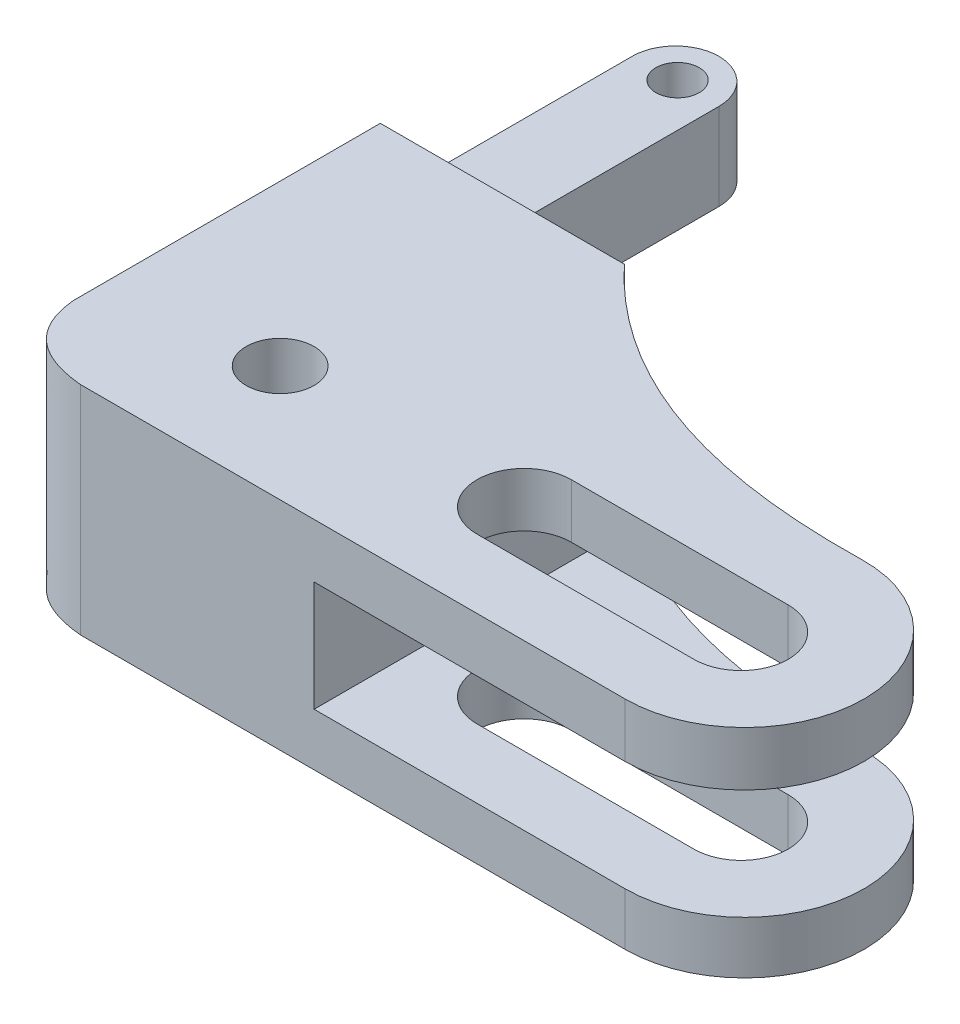
from build123d import *

# Parameters (mm, degrees)
SKETCH1_R           = 6.25
BOSS_EXTRUDE1_DEPTH = 40
SKETCH3_W           = 16
SKETCH3_H           = 16
BOSS_EXTRUDE2_DEPTH = 55
SKETCH4_W           = 79.487617275
SKETCH4_H           = 20.321855451
CUT_EXTRUDE1_DEPTH  = 60.08
CUT_EXTRUDE2_DEPTH  = 60.08
SKETCH8_R           = 4
CUT_EXTRUDE3_DEPTH  = 60.08


with BuildPart() as part:
    # Sketch1 → Boss-Extrude1 (new body)
    with BuildSketch(Plane(origin=(0, 0, 0), x_dir=(1, 0, 0), z_dir=(0, 1, 0))):
        with BuildLine():
            Line((-45, 0), (0, 0))
            add(Edge.make_bspline(
                [(0, 0), (17.365983088, -18.556062235), (40.507326339, -25.876534392), (69.05598636, -25.291140997)],
                knots=[0, 0, 0, 0, 1, 1, 1, 1], degree=3))
            ThreePointArc((69.05598636, -25.291140997), (91.549113489, -47.102951703), (69.507873161, -69.371305461))
            Line((69.507873161, -69.371305461), (-19.337413001, -69.371305461))
            Line((-19.337413001, -69.371305461), (-30.918760516, -69.371305461))
            add(Edge.make_bspline(
                [(-45, -56.695680455), (-43.898759302, -68.233062502), (-30.918760516, -69.371305461)],
                knots=[0, 0, 0, 1, 1, 1], degree=2))
            Line((-45, -56.695680455), (-45, -50.496042729))
            Line((-45, -50.496042729), (-45, 0))
        make_face()
        with Locations(Location((-15.478366003, -48, 0), (0, 0, 270))):
            Circle(SKETCH1_R, mode=Mode.SUBTRACT)
        with BuildLine():
            Line((29.521633997, -39.304319545), (69.521633997, -39.304319545))
            ThreePointArc((69.521633997, -39.304319545), (78.217314452, -48), (69.521633997, -56.695680455))
            Line((69.521633997, -56.695680455), (29.521633997, -56.695680455))
            ThreePointArc((29.521633997, -56.695680455), (20.825953542, -48), (29.521633997, -39.304319545))
        make_face(mode=Mode.SUBTRACT)
    extrude(amount=BOSS_EXTRUDE1_DEPTH)

    # Sketch3 → Boss-Extrude2 (add)
    with BuildSketch(Plane(origin=(0, 0, 0), x_dir=(-1, 0, 0), z_dir=(0, 0, -1))):
        with Locations((37, 19.479254529)):
            Rectangle(SKETCH3_W, SKETCH3_H)
    extrude(amount=BOSS_EXTRUDE2_DEPTH)

    # Sketch4 → Cut-Extrude1 (cut)
    with BuildSketch(Plane.XY.offset(69.371305461)):
        with Locations((51.911602749, 19.849304399)):
            Rectangle(SKETCH4_W, SKETCH4_H)
    extrude(amount=-CUT_EXTRUDE1_DEPTH, mode=Mode.SUBTRACT)

    # Sketch7 → Cut-Extrude2 (cut)
    with BuildSketch(Plane(origin=(0, 27.479254529, 0), x_dir=(1, 0, 0), z_dir=(0, 1, 0))):
        with BuildLine():
            Line((-45, 46.438944543), (-45, 55))
            Line((-45, 55), (-29, 55))
            Line((-29, 55), (-29, 46.438944543))
            ThreePointArc((-29, 46.438944543), (-37, 54.438944543), (-45, 46.438944543))
        make_face()
    extrude(amount=-CUT_EXTRUDE2_DEPTH, mode=Mode.SUBTRACT)

    # Sketch8 → Cut-Extrude3 (cut)
    with BuildSketch(Plane(origin=(0, 27.479254529, 0), x_dir=(1, 0, 0), z_dir=(0, 1, 0))):
        with Locations(Location((-37, 46.819480791, 0), (0, 0, 180))):
            Circle(SKETCH8_R)
    extrude(amount=-CUT_EXTRUDE3_DEPTH, mode=Mode.SUBTRACT)


solid = part.part
